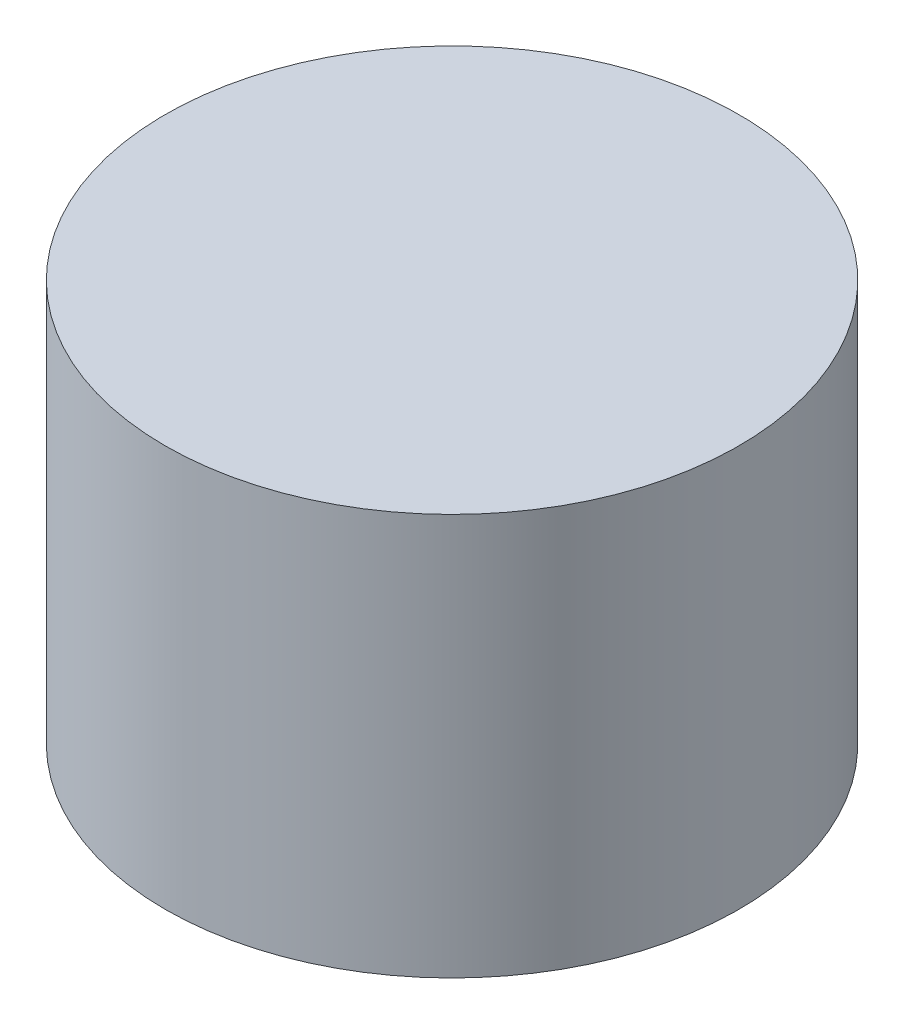
from build123d import *

# Parameters (mm, degrees)
SKETCH1_R           = 27.8
BOSS_EXTRUDE1_DEPTH = 38.9


with BuildPart() as part:
    # Sketch1 → Boss-Extrude1 (new body)
    with BuildSketch(Plane(origin=(0, 0, 0), x_dir=(1, 0, 0), z_dir=(0, 1, 0))):
        with Locations(Location((0, 0, 0), (0, 0, 270))):
            Circle(SKETCH1_R)
    extrude(amount=BOSS_EXTRUDE1_DEPTH)


solid = part.part
